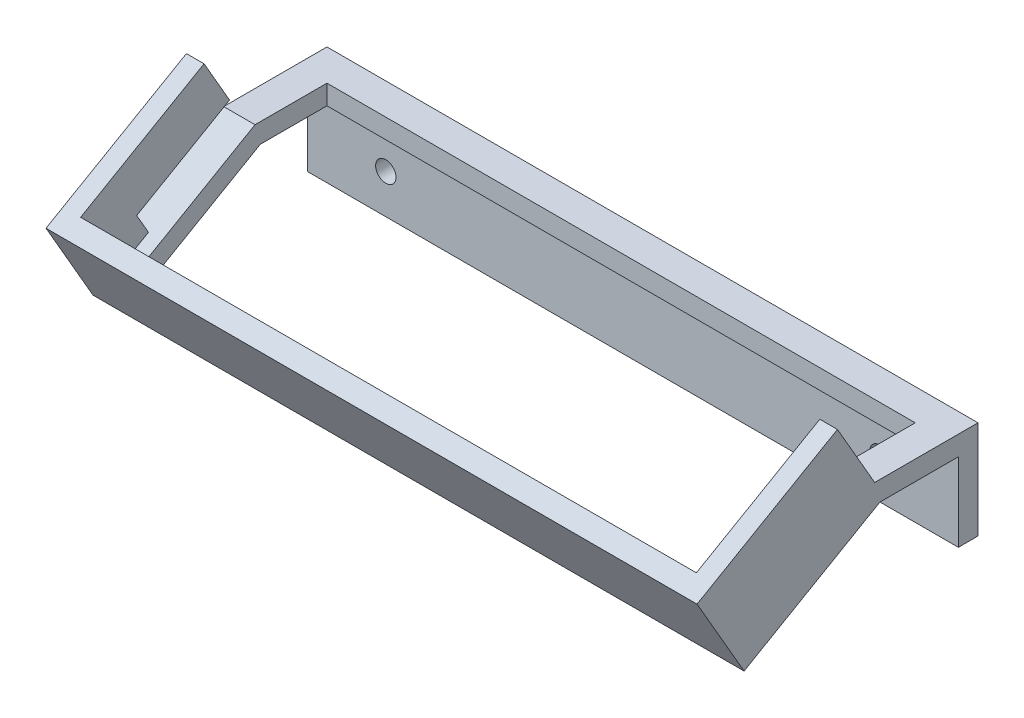
from build123d import *

# Parameters (mm, degrees)
BOSS_EXTRUDE1_DEPTH = 83
SKETCH2_W           = 4.5
SKETCH2_H           = 36.339745962
BOSS_EXTRUDE2_DEPTH = 19
SKETCH3_W           = 150
SKETCH3_H           = 18.339745962
CUT_EXTRUDE1_DEPTH  = 6
SKETCH4_W           = 150
SKETCH4_H           = 31.34
CUT_EXTRUDE2_DEPTH  = 5
CUT_EXTRUDE3_DEPTH  = 5
SKETCH6_R           = 2.6
CUT_EXTRUDE4_DEPTH  = 5


with BuildPart() as part:
    # Sketch1 → Boss-Extrude1 (new, symmetric)
    with BuildSketch(Plane(origin=(0, 0, 0), x_dir=(0, 0, -1), z_dir=(1, 0, 0))):
        Polygon((0, 0), (0, 20), (-20, 20), (-54.641016151, 0), (-66.641016151, 20.784609691), (-62.310889132, 23.284609691), (-52.810889132, 6.830127019), (-21.339745962, 25), (5, 25), (5, 0), align=None)
    extrude(amount=BOSS_EXTRUDE1_DEPTH, both=True)

    # Sketch2 → Boss-Extrude2 (add)
    with BuildSketch(Plane(origin=(0, 27.990381057, 16.160254038), x_dir=(1, 0, 0), z_dir=(0, 0.866025403784436, 0.5000000000000044))):
        with Locations((-80.75, -24.150635095)):
            Rectangle(SKETCH2_W, SKETCH2_H)
        with Locations((80.75, -24.150635095)):
            Rectangle(SKETCH2_W, SKETCH2_H)
    extrude(amount=BOSS_EXTRUDE2_DEPTH)

    # Sketch3 → Cut-Extrude1 (cut)
    with BuildSketch(Plane(origin=(0, 25, 0), x_dir=(1, 0, 0), z_dir=(0, 1, 0))):
        with Locations((0, -12.169872981)):
            Rectangle(SKETCH3_W, SKETCH3_H)
    extrude(amount=-CUT_EXTRUDE1_DEPTH, mode=Mode.SUBTRACT)

    # Sketch4 → Cut-Extrude2 (cut)
    with BuildSketch(Plane(origin=(0, 27.990381057, 16.160254038), x_dir=(1, 0, 0), z_dir=(0, 0.8660254037844362, 0.5000000000000046))):
        with Locations((0, -21.650762114)):
            Rectangle(SKETCH4_W, SKETCH4_H)
    extrude(amount=-CUT_EXTRUDE2_DEPTH, mode=Mode.SUBTRACT)

    # Sketch5 → Cut-Extrude3 (cut)
    with BuildSketch(Plane.ZY.offset(83)):
        Polygon((21.339745962, 25), (45.016880502, 11.33), (48.016880502, 16.526152423), (24.339745962, 30.196152423), align=None)
    extrude(amount=-CUT_EXTRUDE3_DEPTH, mode=Mode.SUBTRACT)

    # Sketch6 → Cut-Extrude4 (cut)
    with BuildSketch(Plane(origin=(0, 0, -5), x_dir=(-1, 0, 0), z_dir=(0, 0, -1))):
        with Locations((-63, 10)):
            Circle(SKETCH6_R)
        with Locations((63, 10)):
            Circle(SKETCH6_R)
    extrude(amount=-CUT_EXTRUDE4_DEPTH, mode=Mode.SUBTRACT)


solid = part.part
